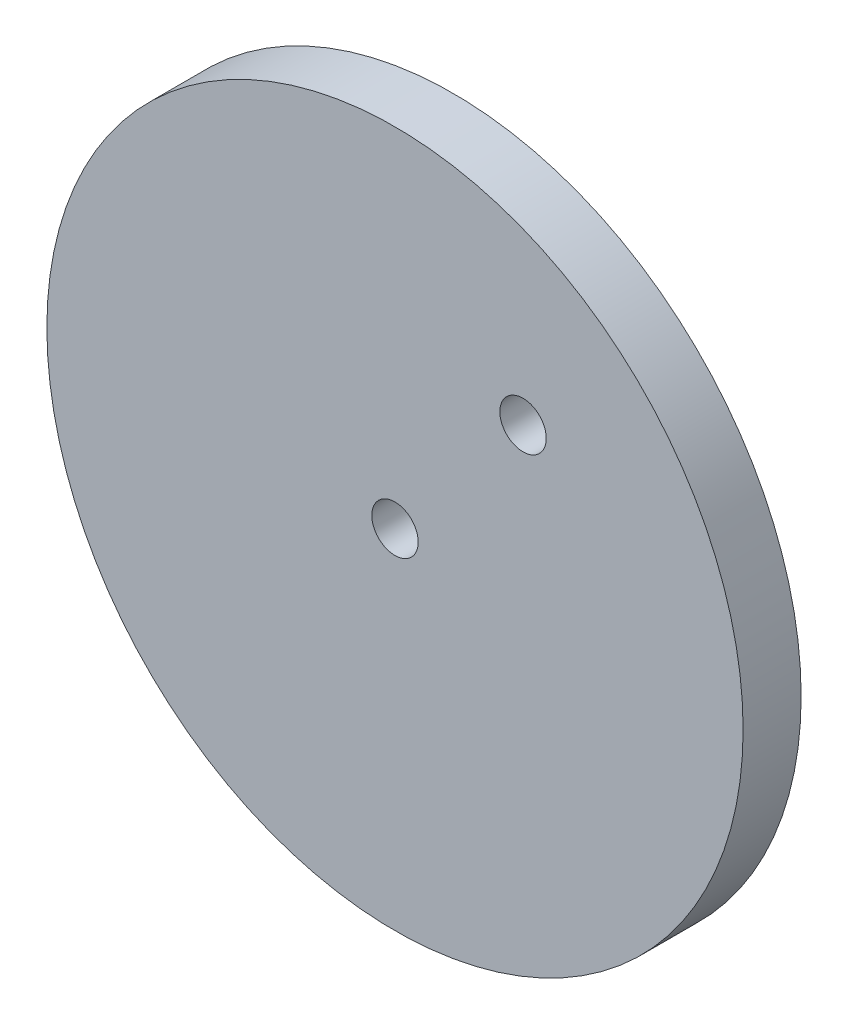
from build123d import *

# Parameters (mm, degrees)
SKETCH_1_R          = 30
EXTRUDE_1_DEPTH     = 5
SKETCH_2_R          = 2
CUT_EXTRUDE_1_DEPTH = 5


with BuildPart() as part:
    # 草图1 → 凸台-拉伸1 (new body)
    with BuildSketch(Plane.XY):
        Circle(SKETCH_1_R)
    extrude(amount=EXTRUDE_1_DEPTH)

    # 草图2 → 切除-拉伸1 (cut)
    with BuildSketch(Plane.XY.offset(5)):
        Circle(SKETCH_2_R)
        with Locations((11.035275263, 13.258401105)):
            Circle(SKETCH_2_R)
    extrude(amount=-CUT_EXTRUDE_1_DEPTH, mode=Mode.SUBTRACT)


solid = part.part
